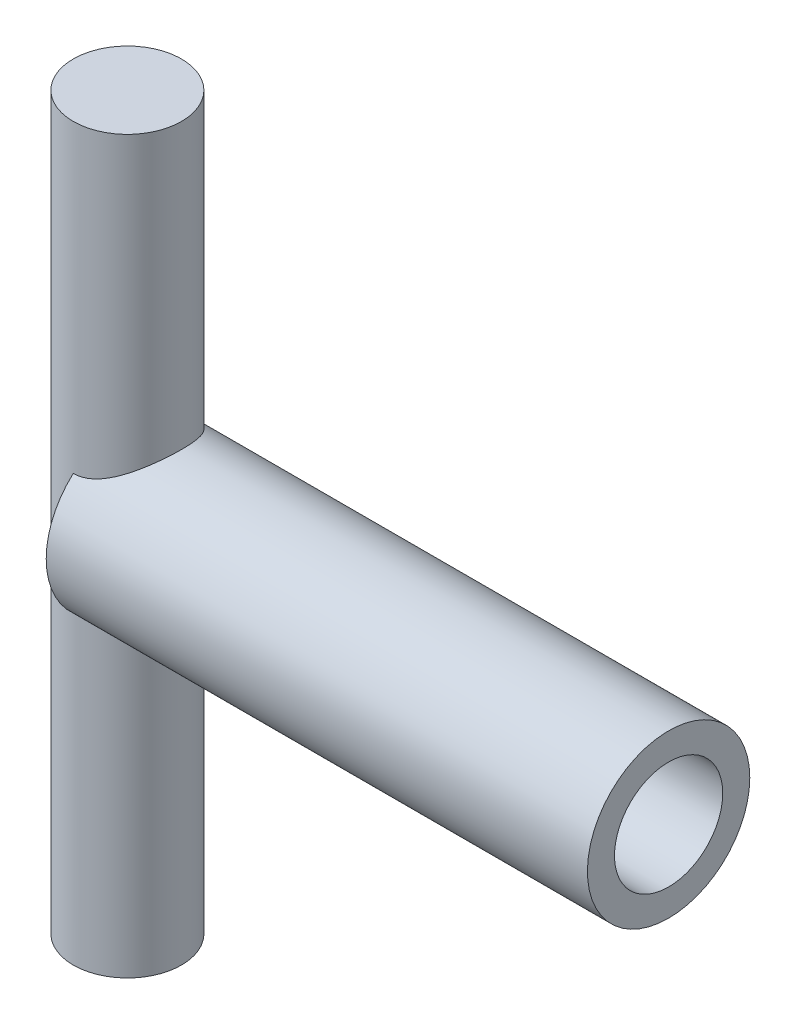
from build123d import *

# Parameters (mm, degrees)
SKETCH_1_R           = 1
EXTRUDE_1_DEPTH      = 13.5
SKETCH_4_R           = 1.5
EXTRUDE_3_DEPTH      = 10
SKETCH_7_R           = 1
CUT_EXTRUDE_15_DEPTH = 9


with BuildPart() as part:
    # 草图1 → 凸台-拉伸1 (new body)
    with BuildSketch(Plane(origin=(0, 0, 0), x_dir=(1, 0, 0), z_dir=(0, 1, 0))):
        Circle(SKETCH_1_R)
    extrude(amount=EXTRUDE_1_DEPTH)

    # 草图4 → 凸台-拉伸3 (add)
    with BuildSketch(Plane(origin=(0, 0, 0), x_dir=(0, 0, -1), z_dir=(1, 0, 0))):
        with Locations((0, 6.75)):
            Circle(SKETCH_4_R)
    extrude(amount=EXTRUDE_3_DEPTH)

    # 草图7 → 切除-拉伸15 (cut)
    with BuildSketch(Plane(origin=(10, 0, 0), x_dir=(0, 0, -1), z_dir=(1, 0, 0))):
        with Locations((0, 6.75)):
            Circle(SKETCH_7_R)
    extrude(amount=-CUT_EXTRUDE_15_DEPTH, mode=Mode.SUBTRACT)


solid = part.part
